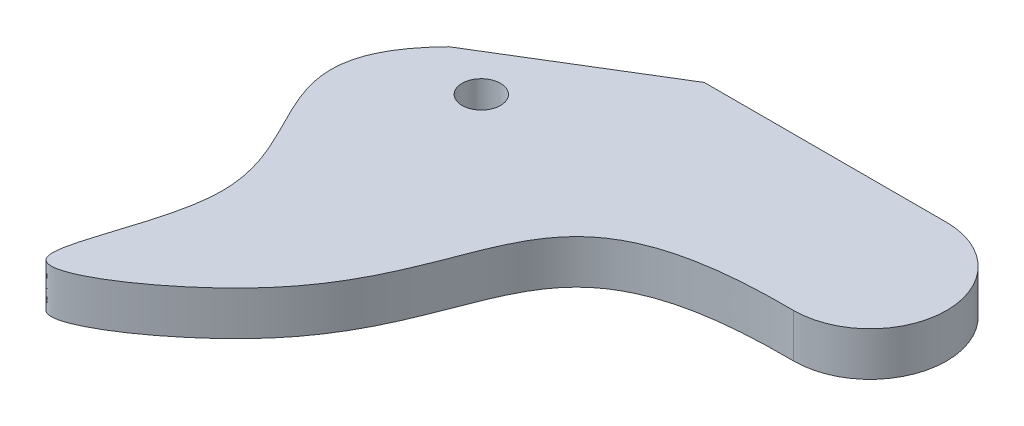
from build123d import *

# Parameters (mm, degrees)
SKETCH1_R           = 1.975
BOSS_EXTRUDE1_DEPTH = 4.5


with BuildPart() as part:
    # Sketch1 → Boss-Extrude1 (new body)
    with BuildSketch(Plane(origin=(0, 0, 0), x_dir=(1, 0, 0), z_dir=(0, 1, 0))):
        with BuildLine():
            Line((-13.228906831, 8.035454857), (11.653019328, 8.035454857))
            ThreePointArc((11.653019328, 8.035454857), (19.500813905, 0.18766028), (11.653019328, -7.660134297))
            add(Edge.make_bspline(
                [(-29.52780186, -1.905400328), (-39.373883883, -12.042706391), (-21.483793828, -19.622495207), (-37.061153407, -48.094157894), (-2.778991885, -24.805967723), (-14.138969584, -7.373351198), (11.653019328, -7.660134297)],
                knots=[0, 0, 0, 0, 0.264966168, 0.418851032, 0.587126028, 1, 1, 1, 1], degree=3))
            Line((-29.52780186, -1.905400328), (-13.228906831, 8.035454857))
        make_face()
        with Locations(Location((-23.620555115, -4.478995902, 0), (0, 0, 270))):
            Circle(SKETCH1_R, mode=Mode.SUBTRACT)
    extrude(amount=BOSS_EXTRUDE1_DEPTH)


solid = part.part
